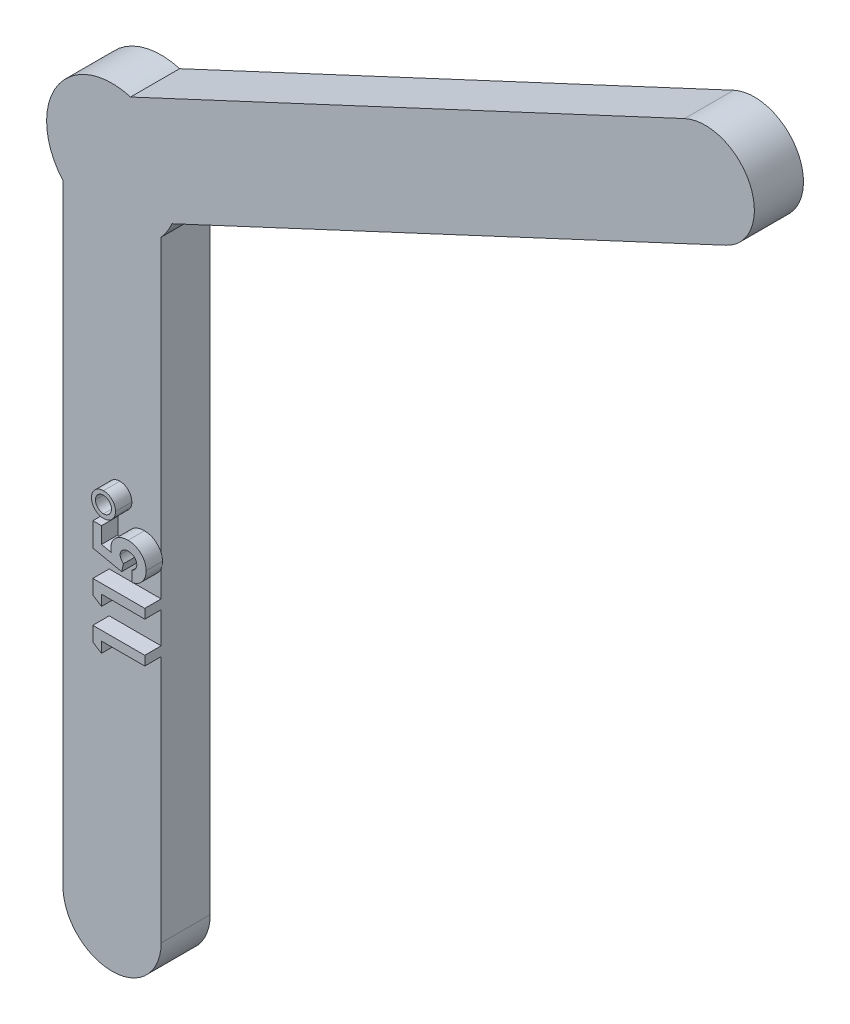
from build123d import *

# Parameters (mm, degrees)
BOSS_EXTRUDE1_DEPTH = 3
BOSS_EXTRUDE2_DEPTH = 1


with BuildPart() as part:
    # Sketch2 → Boss-Extrude1 (new body)
    with BuildSketch(Plane.XY):
        with BuildLine():
            Line((-3, -40), (-3, -2.645751311))
            ThreePointArc((-3, -2.645751311), (-3.373565783, 2.149198433), (1.130010231, 3.837066181))
            Line((1.130010231, 3.837066181), (34.984456696, 19.623653831))
            ThreePointArc((34.984456696, 19.623653831), (38.971234843, 18.172585255), (37.520166267, 14.185807109))
            Line((37.520166267, 14.185807109), (3.665719801, -1.600780541))
            ThreePointArc((3.665719801, -1.600780541), (3.373565783, -2.149198433), (3, -2.645751311))
            Line((3, -2.645751311), (3, -40))
            ThreePointArc((3, -40), (0, -43), (-3, -40))
        make_face()
    extrude(amount=BOSS_EXTRUDE1_DEPTH)

    # Sketch3 → Boss-Extrude2 (add)
    # profile 1 of 4: a face of its own
    with BuildSketch(Plane.XY.offset(3)):
        Polygon((-0.175, -25.154881865), (-0.175, -24.27399745), (3, -24.27399745), (3, -24.843869245), (0.354166667, -24.843869245), (0.354166667, -25.495151297), align=None)
    # profile 2 of 4: a face of its own
    with BuildSketch(Plane.XY.offset(3)):
        Polygon((-0.175, -22.671869045), (-0.175, -21.79098463), (3, -21.79098463), (3, -22.360856425), (0.354166667, -22.360856425), (0.354166667, -23.012138476), align=None)
    # profile 3 of 4: a face of its own
    with BuildSketch(Plane.XY.offset(3)):
        with BuildLine():
            Line((-0.175, -20.183768083), (-0.175, -18.738100015))
            Line((-0.175, -18.738100015), (0.354166667, -18.738100015))
            Line((0.354166667, -18.738100015), (0.354166667, -19.732195567))
            Line((0.354166667, -19.732195567), (0.954567308, -19.856219005))
            add(Edge.make_bspline(
                [(0.954567308, -19.856219005), (0.949860453, -19.839319036), (0.940577569, -19.805988826), (0.93126801, -19.755776822), (0.92523385, -19.707114393), (0.924428974, -19.675182404), (0.924038462, -19.659689558)],
                knots=[0, 0, 0, 0, 1.05461699, 2.079921384, 3.068411212, 4, 4, 4, 4], degree=3))
            add(Edge.make_bspline(
                [(0.924038462, -19.659689558), (0.924812065, -19.625929023), (0.926337007, -19.559379571), (0.940813682, -19.462026168), (0.963614006, -19.368804534), (0.996131972, -19.279999936), (1.038454945, -19.195699126), (1.089653878, -19.115799914), (1.149818696, -19.040204237), (1.218987066, -18.970254992), (1.294935502, -18.905982705), (1.377081772, -18.850101616), (1.46425455, -18.80237568), (1.5569957, -18.76441612), (1.654722746, -18.734455199), (1.757498313, -18.712804768), (1.865444205, -18.700001787), (1.93908797, -18.698275384), (1.976647636, -18.697394886)],
                knots=[0, 0, 0, 0, 1.01440847, 1.999622559, 2.951875003, 3.895578053, 4.836219714, 5.782137149, 6.743708247, 7.735272588, 8.734977101, 9.730283169, 10.717124674, 11.717316708, 12.737475749, 13.78628267, 14.87096371, 16, 16, 16, 16], degree=3))
            add(Edge.make_bspline(
                [(1.976647636, -18.697394886), (2.014633256, -18.698471741), (2.089589988, -18.700596691), (2.199810405, -18.714436265), (2.305347887, -18.738931282), (2.406436844, -18.772286927), (2.502206798, -18.817114441), (2.594432718, -18.86950591), (2.681133664, -18.933261188), (2.762568124, -19.005297728), (2.837049691, -19.083929276), (2.902401087, -19.167859406), (2.958366099, -19.255679557), (3.002753164, -19.348632215), (3.038048148, -19.445295819), (3.063686875, -19.546005909), (3.078401729, -19.651196908), (3.080396394, -19.722609968), (3.081410256, -19.758908308)],
                knots=[0, 0, 0, 0, 1.068214675, 2.107899807, 3.117335077, 4.110871058, 5.095206435, 6.086091645, 7.088956472, 8.115291905, 9.140102477, 10.129911027, 11.102477109, 12.062389472, 13.02046727, 13.992137592, 14.979429371, 16, 16, 16, 16], degree=3))
            add(Edge.make_bspline(
                [(3.081410256, -19.758908308), (3.080553487, -19.79136238), (3.078863759, -19.855368603), (3.069191791, -19.949797139), (3.049983355, -20.040361332), (3.025867721, -20.127954099), (2.992625683, -20.211364404), (2.954425098, -20.292311041), (2.90646499, -20.368357239), (2.853629949, -20.441663431), (2.793625688, -20.50941149), (2.728785352, -20.572313591), (2.657896897, -20.627976986), (2.582338125, -20.678475495), (2.500698196, -20.721065381), (2.414445642, -20.75913827), (2.322609586, -20.790241595), (2.258952506, -20.806035325), (2.226602564, -20.814061553)],
                knots=[0, 0, 0, 0, 1.055144606, 2.080965977, 3.079696235, 4.061281178, 5.030010203, 5.994686618, 6.966205752, 7.947572972, 8.929036963, 9.903776773, 10.879904045, 11.854643856, 12.853445432, 13.868704235, 14.916895142, 16, 16, 16, 16], degree=3))
            Line((2.226602564, -20.814061553), (2.226602564, -20.162779502))
            add(Edge.make_bspline(
                [(2.226602564, -20.162779502), (2.2490257, -20.150877837), (2.292602504, -20.127748308), (2.350368396, -20.083684636), (2.399871513, -20.034694032), (2.440196073, -19.979977241), (2.472150078, -19.921350826), (2.495375872, -19.859110815), (2.509002642, -19.793633158), (2.510687604, -19.749006554), (2.511538462, -19.726471409)],
                knots=[0, 0, 0, 0, 1.10506944, 2.147576346, 3.153981456, 4.13180336, 5.099527609, 6.055753385, 7.01821161, 8, 8, 8, 8], degree=3))
            add(Edge.make_bspline(
                [(2.511538462, -19.726471409), (2.510947576, -19.710766669), (2.509785, -19.679867328), (2.50363468, -19.634342036), (2.491986113, -19.590886145), (2.475855555, -19.54917657), (2.455738928, -19.509101269), (2.430342997, -19.471234736), (2.401111339, -19.434918161), (2.367567912, -19.400704428), (2.330174793, -19.369716649), (2.289993338, -19.342543756), (2.247916387, -19.318247442), (2.202277167, -19.300250791), (2.154438481, -19.285513055), (2.104039466, -19.274659591), (2.051021262, -19.268173422), (2.01482722, -19.267572976), (1.996364183, -19.267266681)],
                knots=[0, 0, 0, 0, 0.978869489, 1.925942215, 2.855067702, 3.774946051, 4.70828698, 5.642468714, 6.60995405, 7.609372294, 8.622401667, 9.629904756, 10.629323, 11.642352373, 12.678539694, 13.745912462, 14.850161547, 16, 16, 16, 16], degree=3))
            add(Edge.make_bspline(
                [(1.996364183, -19.267266681), (1.978329715, -19.267622172), (1.943225185, -19.268314143), (1.891679164, -19.274038269), (1.842771306, -19.284278613), (1.796127073, -19.298231195), (1.752029496, -19.316092075), (1.71021687, -19.337919589), (1.670897628, -19.363805519), (1.634883088, -19.393894299), (1.601818883, -19.425964762), (1.573009836, -19.46047579), (1.548770358, -19.496776329), (1.528965852, -19.534799214), (1.512557035, -19.574195974), (1.502358941, -19.61585546), (1.494574966, -19.658764191), (1.494134135, -19.688060493), (1.493910256, -19.702938756)],
                knots=[0, 0, 0, 0, 1.166353127, 2.270334681, 3.348811111, 4.394351869, 5.415506664, 6.421447184, 7.440758738, 8.453871, 9.452682422, 10.416618495, 11.356052082, 12.270018172, 13.186757755, 14.10810127, 15.039190426, 16, 16, 16, 16], degree=3))
            add(Edge.make_bspline(
                [(1.493910256, -19.702938756), (1.49450671, -19.719102911), (1.49570213, -19.751499345), (1.505940133, -19.799465256), (1.521093441, -19.847275752), (1.543719924, -19.894308853), (1.572750982, -19.941006888), (1.607825567, -19.98745024), (1.6495043, -20.033451041), (1.680674523, -20.062516595), (1.69679988, -20.07755314)],
                knots=[0, 0, 0, 0, 0.882519632, 1.768758668, 2.670168731, 3.618680561, 4.612333577, 5.671392632, 6.795336641, 8, 8, 8, 8], degree=3))
            Line((1.69679988, -20.07755314), (1.58676883, -20.557110431))
            Line((1.58676883, -20.557110431), (-0.175, -20.183768083))
        make_face()
    # profile 4 of 4: a face of its own
    with BuildSketch(Plane.XY.offset(3)):
        with BuildLine():
            add(Edge.make_bspline(
                [(0.476282051, -16.824958989), (0.501543872, -16.825505484), (0.55122174, -16.826580176), (0.624352745, -16.837013476), (0.694208258, -16.854492691), (0.761803607, -16.876903338), (0.825395964, -16.908042089), (0.886396731, -16.944903837), (0.943669883, -16.989402672), (0.9978957, -17.039014969), (1.047295391, -17.093515132), (1.090947065, -17.151405488), (1.127096601, -17.212864468), (1.157366856, -17.276577248), (1.180332148, -17.343408663), (1.196689885, -17.412864586), (1.20741609, -17.485236986), (1.208449037, -17.534503871), (1.208974359, -17.559559349)],
                knots=[0, 0, 0, 0, 1.048753193, 2.062393874, 3.059725798, 4.03711221, 5.013824111, 5.993903926, 6.992478922, 8.020738441, 9.043061753, 10.043343452, 11.026424807, 11.999358773, 12.968420071, 13.955122655, 14.960044262, 16, 16, 16, 16], degree=3))
            add(Edge.make_bspline(
                [(1.208974359, -17.559559349), (1.208454225, -17.584616682), (1.207431478, -17.633887214), (1.196631189, -17.706233128), (1.180530583, -17.775855144), (1.156529218, -17.842391691), (1.126678292, -17.90615653), (1.090260147, -17.967072817), (1.046482503, -18.024600993), (0.996781055, -18.078582797), (0.942375086, -18.128107638), (0.88420218, -18.171482912), (0.823225465, -18.208946116), (0.758107997, -18.237837437), (0.69067286, -18.261947038), (0.619758864, -18.27798784), (0.545943315, -18.288833106), (0.495615647, -18.289833085), (0.469921875, -18.290343604)],
                knots=[0, 0, 0, 0, 1.037227242, 2.039512271, 3.023626077, 3.993053151, 4.963434463, 5.936395473, 6.927031705, 7.952593414, 8.972234493, 9.969891786, 10.954906455, 11.929570282, 12.915563215, 13.916770353, 14.936449251, 16, 16, 16, 16], degree=3))
            add(Edge.make_bspline(
                [(0.469921875, -18.290343604), (0.445290866, -18.289811451), (0.396869022, -18.288765297), (0.325492116, -18.278103661), (0.256787066, -18.261182775), (0.190979117, -18.23681523), (0.128167681, -18.205730248), (0.067236284, -18.169180135), (0.010175979, -18.123937412), (-0.044275745, -18.073515722), (-0.093962638, -18.018218509), (-0.137555056, -17.95952238), (-0.173973759, -17.89802202), (-0.203993097, -17.834134423), (-0.227847104, -17.767768562), (-0.244158222, -17.698411219), (-0.254789074, -17.626671533), (-0.255866772, -17.577830012), (-0.256410256, -17.553199173)],
                knots=[0, 0, 0, 0, 1.027628768, 2.020204677, 3.0054932, 3.977172113, 4.942988595, 5.928118098, 6.937247537, 7.976812879, 9.023474825, 10.036014018, 11.024160528, 12.002107364, 12.979092523, 13.962271943, 14.972371232, 16, 16, 16, 16], degree=3))
            add(Edge.make_bspline(
                [(-0.256410256, -17.553199173), (-0.255881051, -17.528566172), (-0.254836181, -17.479930408), (-0.244068832, -17.408427146), (-0.227959354, -17.339440503), (-0.203981879, -17.27352423), (-0.173948227, -17.210285117), (-0.137706982, -17.149501332), (-0.093944483, -17.091941849), (-0.043999627, -17.038019265), (0.009956511, -16.987787182), (0.068273488, -16.944627592), (0.128824771, -16.907104674), (0.192846684, -16.877455064), (0.259342082, -16.853394895), (0.329176204, -16.837233977), (0.401748506, -16.826543556), (0.451226198, -16.825491671), (0.476282051, -16.824958989)],
                knots=[0, 0, 0, 0, 1.02774298, 2.029191086, 3.012479778, 3.981238486, 4.951290381, 5.931946007, 6.930416638, 7.964088953, 8.997761269, 10.003308488, 10.98854748, 11.966603007, 12.943696749, 13.935593372, 14.954569896, 16, 16, 16, 16], degree=3))
        make_face()
        with BuildLine():
            add(Edge.make_bspline(
                [(0.479462139, -17.069189758), (0.462471258, -17.069424264), (0.428972226, -17.069886612), (0.379883793, -17.077505977), (0.332524379, -17.088023775), (0.287283463, -17.10328392), (0.24427911, -17.123234284), (0.203398935, -17.147571829), (0.164484674, -17.176174899), (0.128492582, -17.209237523), (0.095853701, -17.245103846), (0.066652511, -17.282897251), (0.042455186, -17.323086522), (0.023016589, -17.365273093), (0.006315159, -17.408801858), (-0.003707976, -17.454711924), (-0.01154919, -17.502263298), (-0.011966436, -17.534718897), (-0.012179487, -17.55129112)],
                knots=[0, 0, 0, 0, 1.061159961, 2.092171217, 3.098605391, 4.092036902, 5.070589041, 6.057187883, 7.061962211, 8.084674938, 9.107387665, 10.090954379, 11.06617917, 12.032717429, 12.99305519, 13.973669989, 14.965331307, 16, 16, 16, 16], degree=3))
            add(Edge.make_bspline(
                [(-0.012179487, -17.55129112), (-0.01157068, -17.568051412), (-0.01036426, -17.601263796), (-0.004409395, -17.650200831), (0.007572839, -17.69685371), (0.022606002, -17.742054962), (0.043122897, -17.784898142), (0.067542797, -17.826391236), (0.096744971, -17.865435361), (0.129769422, -17.902214665), (0.165718261, -17.935960463), (0.204573602, -17.964950546), (0.244977971, -17.990352408), (0.287582445, -18.010455361), (0.331832846, -18.026567734), (0.377821945, -18.038209426), (0.425871214, -18.044356322), (0.458458137, -18.045521173), (0.475010016, -18.046112835)],
                knots=[0, 0, 0, 0, 1.042034071, 2.064906527, 3.055369705, 4.030203466, 5.020228521, 6.000742353, 7.017744738, 8.043920206, 9.069249762, 10.075703201, 11.051782302, 12.029903876, 12.99669358, 13.974371501, 14.971122288, 16, 16, 16, 16], degree=3))
            add(Edge.make_bspline(
                [(0.475010016, -18.046112835), (0.491349767, -18.045520146), (0.523514051, -18.044353455), (0.570936909, -18.038223162), (0.616468237, -18.026465839), (0.660506807, -18.010425399), (0.703332854, -17.990458383), (0.743356347, -17.964229259), (0.782721478, -17.935019181), (0.819574977, -17.900938323), (0.853594861, -17.864058718), (0.883277913, -17.824563201), (0.908722399, -17.783622403), (0.929101491, -17.740636346), (0.945194342, -17.696373754), (0.956841315, -17.650387952), (0.962986781, -17.60233779), (0.964151827, -17.56975099), (0.96474359, -17.553199173)],
                knots=[0, 0, 0, 0, 1.017878107, 2.003660885, 2.970612419, 3.939454555, 4.919652619, 5.904816436, 6.913406512, 7.969270601, 9.02513469, 10.033724766, 11.041277553, 12.021475617, 12.990317753, 13.970071221, 14.968938047, 16, 16, 16, 16], degree=3))
            add(Edge.make_bspline(
                [(0.96474359, -17.553199173), (0.964515736, -17.536840687), (0.964066668, -17.504600367), (0.956359019, -17.457448889), (0.946146284, -17.411789288), (0.929505189, -17.368485652), (0.910263551, -17.326033898), (0.884925795, -17.286252494), (0.856415485, -17.247396305), (0.822504018, -17.212069657), (0.787116244, -17.177952839), (0.747777121, -17.149765554), (0.707718654, -17.124520148), (0.665616684, -17.10387006), (0.621397497, -17.089062601), (0.575848465, -17.07693948), (0.528165265, -17.071009446), (0.49579822, -17.069800121), (0.479462139, -17.069189758)],
                knots=[0, 0, 0, 0, 1.029744634, 2.029484694, 3.00508751, 3.97324883, 4.947661161, 5.937798898, 6.940036528, 7.980134083, 9.020231638, 10.033191535, 11.023329272, 12.003497406, 12.979740652, 13.958541426, 14.969648588, 16, 16, 16, 16], degree=3))
        make_face(mode=Mode.SUBTRACT)
    extrude(amount=BOSS_EXTRUDE2_DEPTH)


solid = part.part
